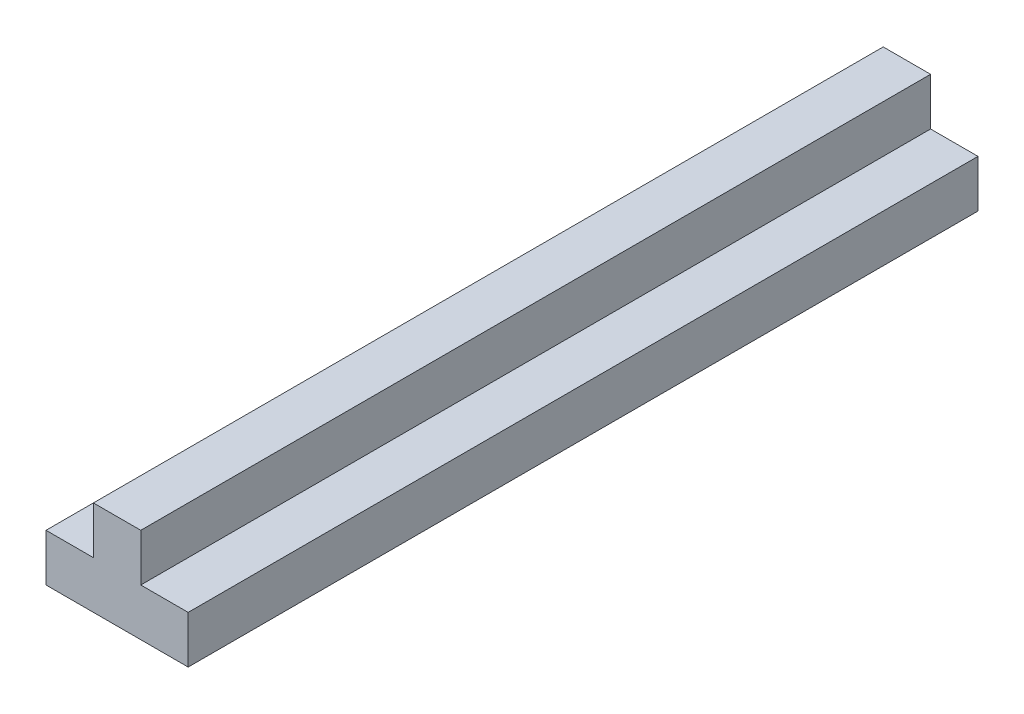
from build123d import *

# Parameters (mm, degrees)
BOSS_EXTRUDE1_DEPTH = 50


with BuildPart() as part:
    # Sketch1 → Boss-Extrude1 (new body)
    with BuildSketch(Plane.XY):
        Polygon((0, 0), (4.5, 0), (4.5, 3), (1.5, 3), (1.5, 6), (-1.5, 6), (-1.5, 3), (-4.5, 3), (-4.5, 0), align=None)
    extrude(amount=BOSS_EXTRUDE1_DEPTH)


solid = part.part
